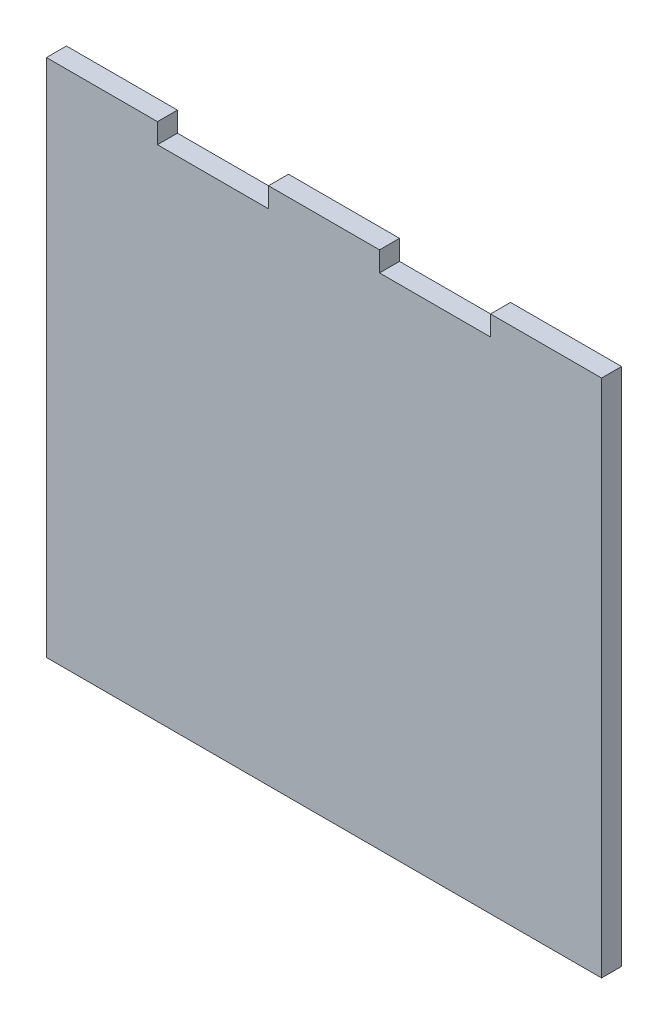
from build123d import *

# Parameters (mm, degrees)
SKETCH1_W           = 127
SKETCH1_H           = 118.872
BOSS_EXTRUDE1_DEPTH = 4.572
SKETCH2_W           = 25.4
SKETCH2_H           = 4.572
CUT_EXTRUDE1_DEPTH  = 4.572


with BuildPart() as part:
    # Sketch1 → Boss-Extrude1 (new body)
    with BuildSketch(Plane.XY):
        with Locations((63.5, 59.436)):
            Rectangle(SKETCH1_W, SKETCH1_H)
    extrude(amount=BOSS_EXTRUDE1_DEPTH)

    # Sketch2 → Cut-Extrude1 (cut)
    with BuildSketch(Plane.XY.offset(4.572)):
        with Locations((38.1, 116.586)):
            Rectangle(SKETCH2_W, SKETCH2_H)
        with Locations((88.9, 116.586)):
            Rectangle(SKETCH2_W, SKETCH2_H)
    extrude(amount=-CUT_EXTRUDE1_DEPTH, mode=Mode.SUBTRACT)


solid = part.part
